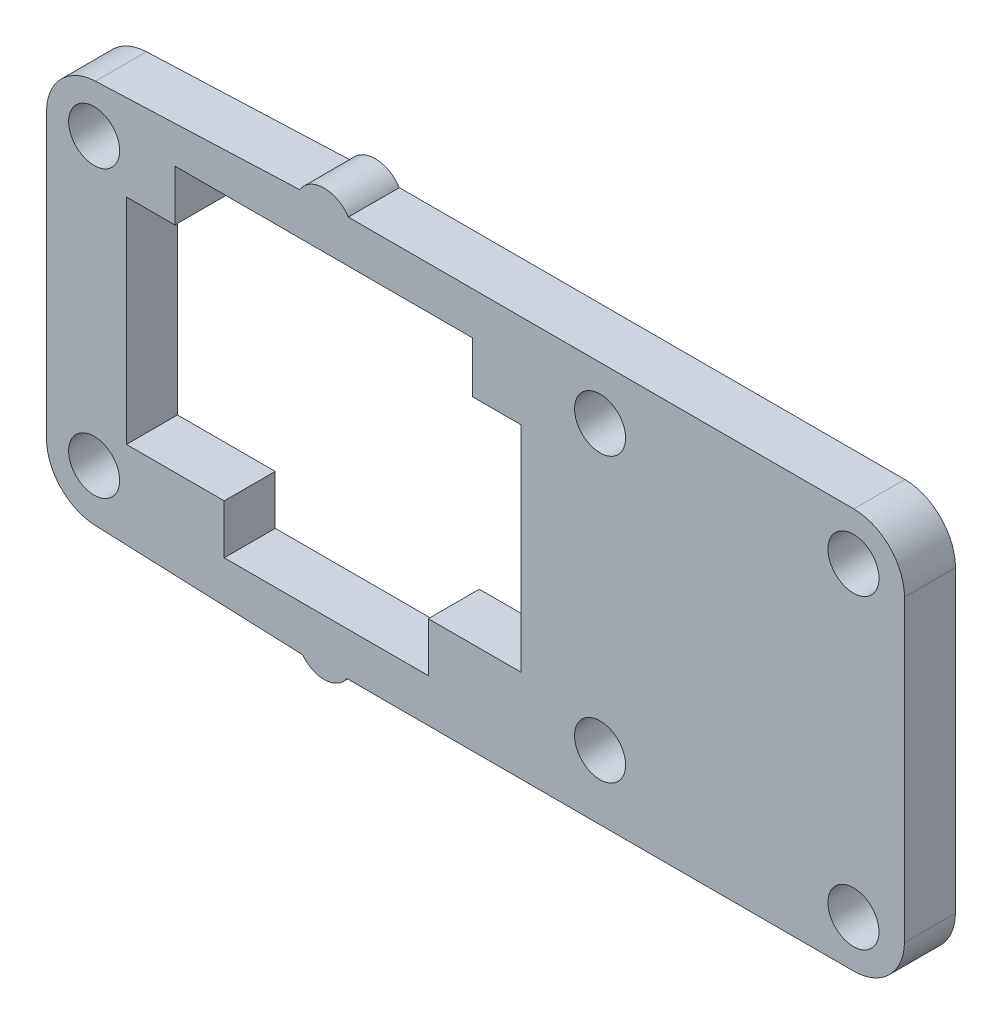
from build123d import *

# Parameters (mm, degrees)
SKETCH1_R           = 1.5
BOSS_EXTRUDE1_DEPTH = 3


with BuildPart() as part:
    # Sketch1 → Boss-Extrude1 (new body)
    with BuildSketch(Plane.XY):
        with BuildLine():
            Line((44.671696982, 20.134210536), (14.948744814, 20.134210536))
            ThreePointArc((14.948744814, 20.134210536), (13.508437041, 20.900264991), (12.086852766, 20.1))
            Line((12.086852766, 20.1), (0.079653818, 19.618721067))
            ThreePointArc((0.079653818, 19.618721067), (-1.951692295, 18.711836018), (-2.8, 16.655338617))
            Line((-2.8, 16.655338617), (-2.8, 0.013082454))
            ThreePointArc((-2.8, 0.013082454), (-1.91420574, -2.147770093), (0.252672107, -3.018721067))
            Line((0.252672107, -3.018721067), (12.259871055, -3.5))
            ThreePointArc((12.259871055, -3.5), (13.584562431, -4.127366103), (14.862137332, -3.408897008))
            Line((14.862137332, -3.408897008), (44.5850895, -3.408897008))
            ThreePointArc((44.5850895, -3.408897008), (46.728413048, -2.573492827), (47.65, -0.465789464))
            Line((47.65, -0.465789464), (47.65, 17.134210536))
            ThreePointArc((47.65, 17.134210536), (46.779005205, 19.247896538), (44.671696982, 20.134210536))
        make_face()
        with Locations((29.75, 17.026583922)):
            Circle(SKETCH1_R, mode=Mode.SUBTRACT)
        with Locations((44.65, 17.334210536)):
            Circle(SKETCH1_R, mode=Mode.SUBTRACT)
        with Locations((44.65, -0.665789465)):
            Circle(SKETCH1_R, mode=Mode.SUBTRACT)
        with Locations((29.75, 0.383476379)):
            Circle(SKETCH1_R, mode=Mode.SUBTRACT)
        Circle(SKETCH1_R, mode=Mode.SUBTRACT)
        with Locations((0, 16.787592152)):
            Circle(SKETCH1_R, mode=Mode.SUBTRACT)
        Polygon((4.75, 14.634210535), (1.9, 14.634210535), (1.9, 2.034210535), (7.65, 2.034210535), (7.65, -0.865789465), (19.65, -0.865789465), (19.65, 2.034210535), (25.1, 2.034210535), (25.1, 14.634210535), (22.25, 14.634210535), (22.25, 17.634210536), (4.75, 17.634210536), align=None, mode=Mode.SUBTRACT)
    extrude(amount=BOSS_EXTRUDE1_DEPTH)


solid = part.part
